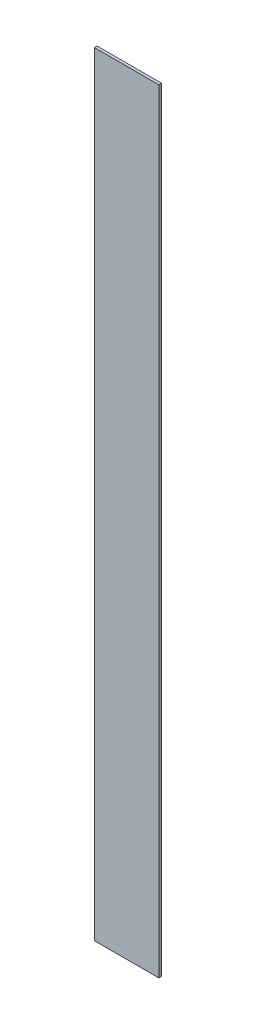
from build123d import *

# Parameters (mm, degrees)
SKETCH1_W           = 76.2
SKETCH1_H           = 914.4
BOSS_EXTRUDE1_DEPTH = 1.5875


with BuildPart() as part:
    # Sketch1 → Boss-Extrude1 (new, symmetric)
    with BuildSketch(Plane.XY):
        Rectangle(SKETCH1_W, SKETCH1_H)
    extrude(amount=BOSS_EXTRUDE1_DEPTH, both=True)


solid = part.part
